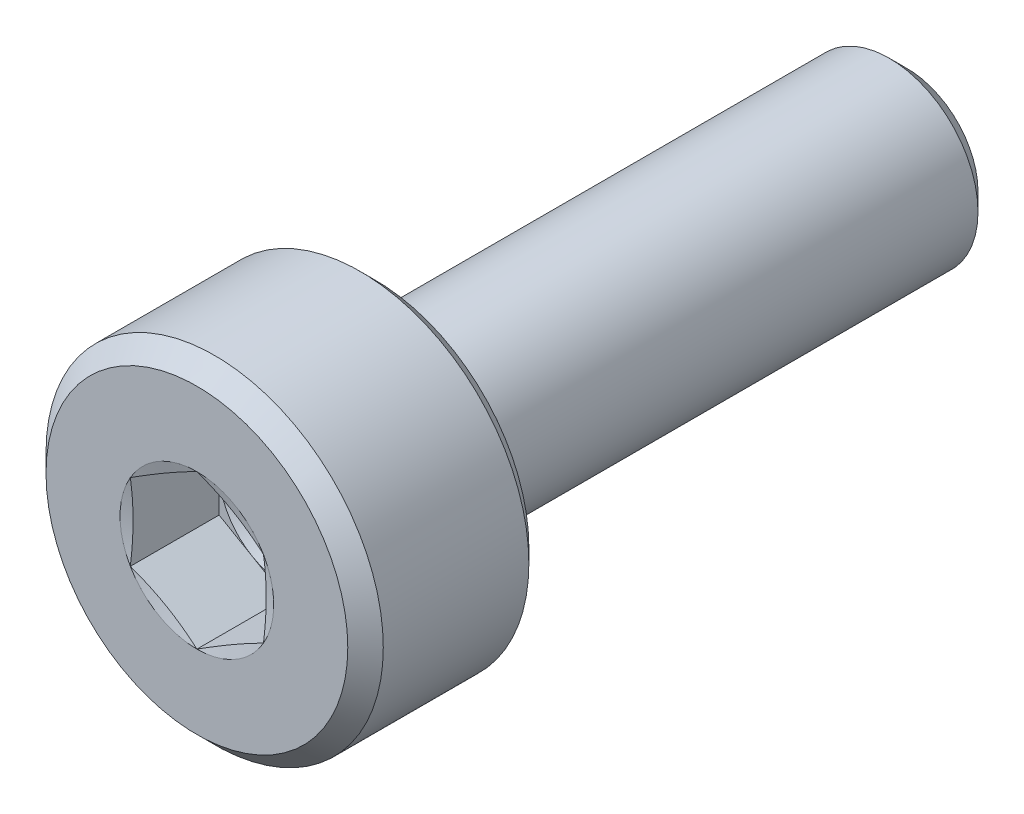
from build123d import *

# Parameters (mm, degrees)
CUT_EXTRUDE1_DEPTH = 1


with BuildPart() as part:
    # Sketch1 → Revolve1 (revolve)
    with BuildSketch(Plane(origin=(0, 0, 0), x_dir=(0, 0, -1), z_dir=(1, 0, 0)), mode=Mode.PRIVATE) as revolve1_sk:
        with BuildLine():
            Line((0, 0), (0, 1.7))
            Line((0, 1.7), (0.2, 1.9))
            Line((0.2, 1.9), (1.84, 1.9))
            Line((1.84, 1.9), (2, 1.74))
            Line((2, 1.74), (2, 1.3))
            ThreePointArc((2, 1.3), (2.015193643, 1.24701055), (2.056157637, 1.210123155))
            Line((2.056157637, 1.210123155), (2.466157637, 1.010123155))
            ThreePointArc((2.466157637, 1.010123155), (2.48750205, 1.00256365), (2.51, 1))
            Line((2.51, 1), (7.8, 1))
            Line((7.8, 1), (8, 0.8))
            Line((8, 0.8), (8, 0))
            Line((8, 0), (0, 0))
        make_face()
    revolve(revolve1_sk.sketch.rotate(Axis((0, 0, 0), (0, 0, -1)), 90), axis=Axis((0, 0, 0), (0, 0, -1)))

    # Sketch2 → Cut-Extrude1 (cut)
    with BuildSketch(Plane.XY):
        Polygon((0, 0.866025404), (-0.75, 0.433012702), (-0.75, -0.433012702), (0, -0.866025404), (0.75, -0.433012702), (0.75, 0.433012702), align=None)
    extrude(amount=-CUT_EXTRUDE1_DEPTH, mode=Mode.SUBTRACT)

    # Sketch3 → Cut-Revolve2 (revolve, cut)
    with BuildSketch(Plane(origin=(0, 0, 0), x_dir=(0, 0, -1), z_dir=(1, 0, 0)), mode=Mode.PRIVATE) as cut_revolve2_sk:
        Polygon((1, 0), (1, 0.75), (1.433012702, 0), align=None)
    revolve(cut_revolve2_sk.sketch.rotate(Axis((0, 0, -1), (0, 0, -1)), 90), axis=Axis((0, 0, -1), (0, 0, -1)), mode=Mode.SUBTRACT)

    # Sketch4 → Cut-Revolve3 (revolve, cut)
    with BuildSketch(Plane(origin=(0, 0, 0), x_dir=(0, 0, -1), z_dir=(1, 0, 0))):
        Polygon((0, 0.866025404), (0, 0.75), (0.031088913, 0.75), align=None)
    revolve(axis=Axis((0, 0, 0), (0, 0, -1)), mode=Mode.SUBTRACT)


solid = part.part
